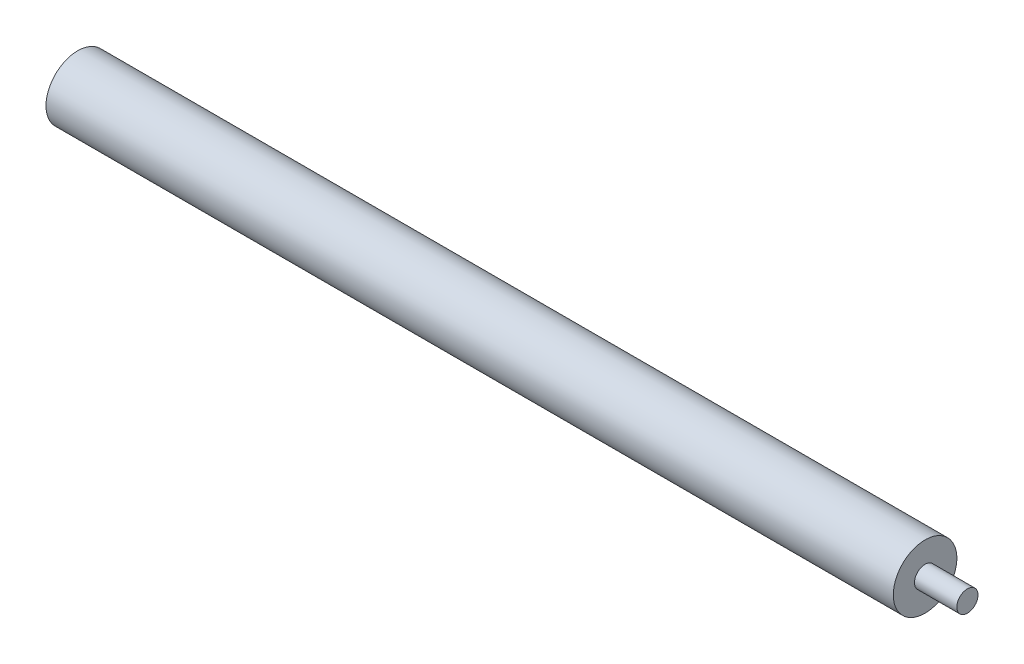
from build123d import *

# Parameters (mm, degrees)
SKETCH2_R          = 0.79375
CUT_EXTRUDE1_DEPTH = 12.7


with BuildPart() as part:
    # Sketch1 → Revolve1 (revolve)
    with BuildSketch(Plane.XY, mode=Mode.PRIVATE) as revolve1_sk:
        Polygon((-266.7, 0), (-266.7, 9.525), (-12.7, 9.525), (-12.7, 3.175), (0, 3.175), (0, 0), align=None)
    revolve(revolve1_sk.sketch.rotate(Axis((-54.16626506, 0, 0), (1, 0, 0)), 90), axis=Axis((-54.16626506, 0, 0), (1, 0, 0)))

    # Sketch2 → Cut-Extrude1 (cut)
    with BuildSketch(Plane.ZY.offset(266.7)):
        Circle(SKETCH2_R)
    extrude(amount=-CUT_EXTRUDE1_DEPTH, mode=Mode.SUBTRACT)


solid = part.part
